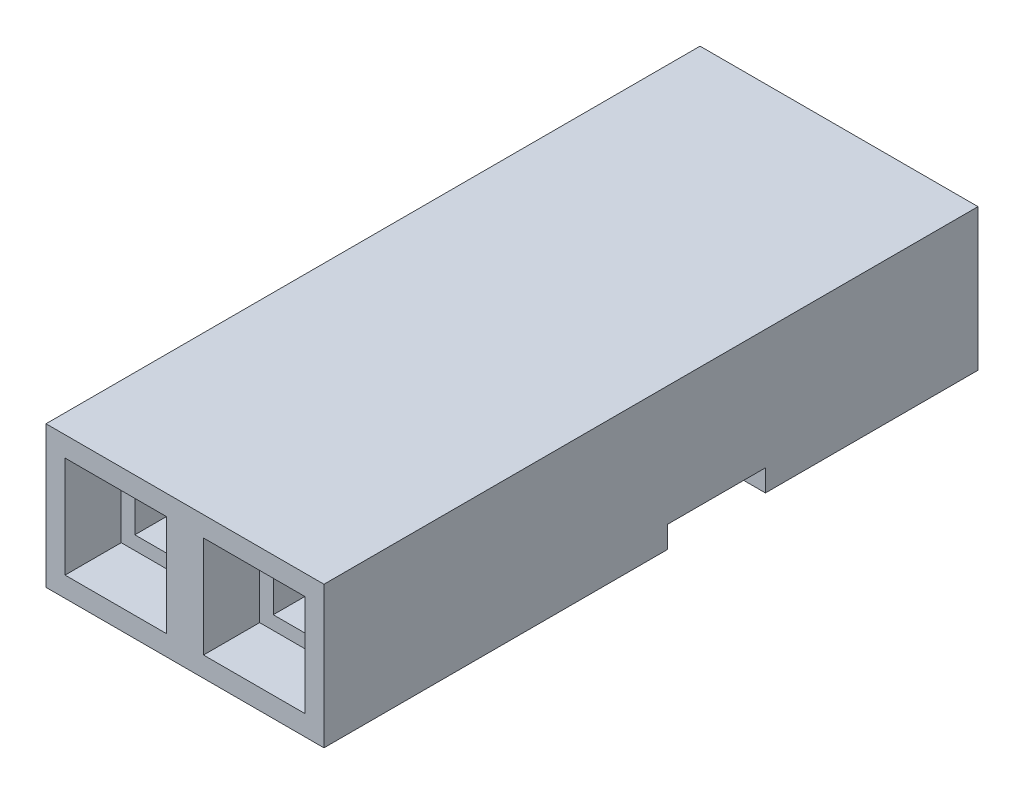
from build123d import *

# Parameters (mm, degrees)
SKETCH1_W               = 5.1
SKETCH1_H               = 14
BOSS_EXTRUDE1_DEPTH     = 1.3
SKETCH2_W               = 1.86
SKETCH2_H               = 1.86
CUT_EXTRUDE1_DEPTH      = 15.289594116
CUT_EXTRUDE2_DEPTH      = 8.562572314
CUT_EXTRUDE2_DEPTH_BACK = 8.562572314
SKETCH3_W               = 1.8
SKETCH3_H               = 0.4
CUT_EXTRUDE3_REACH      = 9.891
SKETCH8_W               = 0.1
SKETCH8_H               = 3.3
BOSS_EXTRUDE2_START     = -1
SKETCH5_W               = 1.86
SKETCH5_H               = 1.86
SKETCH5_W_2             = 0.9
SKETCH5_H_2             = 0.9
BOSS_EXTRUDE2_DEPTH     = 1
CHAMFER2_SIZE           = 0.5
SKETCH6_W               = 1.8
SKETCH6_H               = 1.8
SKETCH6_W_2             = 1.3
SKETCH6_H_2             = 1.3
BOSS_EXTRUDE3_DEPTH     = 10
BOSS_EXTRUDE3_2_DEPTH   = 10
SKETCH7_W               = 1.8
SKETCH7_H               = 1
BOSS_EXTRUDE4_DEPTH     = 0.1
SKETCH9_W               = 5.1
SKETCH9_H               = 2
CUT_EXTRUDE4_DEPTH      = 8.890659035
SKETCH10_W              = 0.9
SKETCH10_H              = 0.85
CUT_EXTRUDE5_DEPTH      = 1


with BuildPart() as part:
    # Sketch1 → Boss-Extrude1 (new, symmetric)
    with BuildSketch(Plane(origin=(0, 0, 0), x_dir=(1, 0, 0), z_dir=(0, 1, 0))):
        Rectangle(SKETCH1_W, SKETCH1_H)
    extrude(amount=BOSS_EXTRUDE1_DEPTH, both=True)

    # Sketch2 → Cut-Extrude1 (cut, through all)
    with BuildSketch(Plane(origin=(0, 0, -7), x_dir=(-1, 0, 0), z_dir=(0, 0, -1))):
        with Locations((-1.27, 0)):
            Rectangle(SKETCH2_W, SKETCH2_H)
        with Locations((1.27, 0)):
            Rectangle(SKETCH2_W, SKETCH2_H)
    extrude(amount=-CUT_EXTRUDE1_DEPTH, mode=Mode.SUBTRACT)

    # Sketch3 → Cut-Extrude2 (cut, two sides: drawn at the far end of the back side and taken through both)
    with BuildSketch(Plane(origin=(0, 0, 0), x_dir=(0, 0, -1), z_dir=(1, 0, 0)).offset(-CUT_EXTRUDE2_DEPTH_BACK)):
        with Locations((2.2, -1.1)):
            Rectangle(SKETCH3_W, SKETCH3_H)
    extrude(amount=CUT_EXTRUDE2_DEPTH + CUT_EXTRUDE2_DEPTH_BACK, mode=Mode.SUBTRACT)

    # Sketch8 → Cut-Extrude3 (cut, up to next)
    with BuildSketch(Plane.XZ.offset(1.3), mode=Mode.PRIVATE) as cut_extrude3_sk1:
        with Locations((-2.15, 0.35)):
            Rectangle(SKETCH8_W, SKETCH8_H)
    cut_extrude3_tool1 = extrude(cut_extrude3_sk1.sketch, amount=-CUT_EXTRUDE3_REACH, mode=Mode.PRIVATE) & part.part
    # Sketch8 → Cut-Extrude3 (cut, up to next)
    with BuildSketch(Plane.XZ.offset(1.3), mode=Mode.PRIVATE) as cut_extrude3_sk2:
        with Locations((-0.39, 0.35)):
            Rectangle(SKETCH8_W, SKETCH8_H)
    cut_extrude3_tool2 = extrude(cut_extrude3_sk2.sketch, amount=-CUT_EXTRUDE3_REACH, mode=Mode.PRIVATE) & part.part
    # Sketch8 → Cut-Extrude3 (cut, up to next)
    with BuildSketch(Plane.XZ.offset(1.3), mode=Mode.PRIVATE) as cut_extrude3_sk3:
        with Locations((0.39, 0.35)):
            Rectangle(SKETCH8_W, SKETCH8_H)
    cut_extrude3_tool3 = extrude(cut_extrude3_sk3.sketch, amount=-CUT_EXTRUDE3_REACH, mode=Mode.PRIVATE) & part.part
    # Sketch8 → Cut-Extrude3 (cut, up to next)
    with BuildSketch(Plane.XZ.offset(1.3), mode=Mode.PRIVATE) as cut_extrude3_sk4:
        with Locations((2.15, 0.35)):
            Rectangle(SKETCH8_W, SKETCH8_H)
    cut_extrude3_tool4 = extrude(cut_extrude3_sk4.sketch, amount=-CUT_EXTRUDE3_REACH, mode=Mode.PRIVATE) & part.part
    add(cut_extrude3_tool1.solids().sort_by_distance((-2.15, -1.3, 0.35))[0], mode=Mode.SUBTRACT)
    add(cut_extrude3_tool2.solids().sort_by_distance((-0.39, -1.3, 0.35))[0], mode=Mode.SUBTRACT)
    add(cut_extrude3_tool3.solids().sort_by_distance((0.39, -1.3, 0.35))[0], mode=Mode.SUBTRACT)
    add(cut_extrude3_tool4.solids().sort_by_distance((2.15, -1.3, 0.35))[0], mode=Mode.SUBTRACT)

    # Sketch5 → Boss-Extrude2 (add)
    # profile 1 of 2: a face of its own
    with BuildSketch(Plane(origin=(0, 0, -7), x_dir=(-1, 0, 0), z_dir=(0, 0, -1)).offset(BOSS_EXTRUDE2_START)):
        with Locations((1.27, 0)):
            Rectangle(SKETCH5_W, SKETCH5_H)
        with Locations((1.27, 0)):
            Rectangle(SKETCH5_W_2, SKETCH5_H_2, mode=Mode.SUBTRACT)
    # profile 2 of 2: a face of its own
    with BuildSketch(Plane(origin=(0, 0, -7), x_dir=(-1, 0, 0), z_dir=(0, 0, -1)).offset(BOSS_EXTRUDE2_START)):
        with Locations((-1.27, 0)):
            Rectangle(SKETCH5_W, SKETCH5_H)
        with Locations((-1.27, 0)):
            Rectangle(SKETCH5_W_2, SKETCH5_H_2, mode=Mode.SUBTRACT)
    extrude(amount=BOSS_EXTRUDE2_DEPTH)

    # Chamfer2
    chamfer2_edges = [part.edges().sort_by_distance(p)[0] for p in [
        (-0.82, 0, -7),
        (-1.27, 0.45, -7),
        (-1.72, 0, -7),
        (-1.27, -0.45, -7),
        (1.72, 0, -7),
        (1.27, 0.45, -7),
        (0.82, 0, -7),
        (1.27, -0.45, -7),
    ]]
    chamfer(chamfer2_edges, length=CHAMFER2_SIZE)

    # Sketch9 → Cut-Extrude4 (cut, through all)
    with BuildSketch(Plane(origin=(0, 1.3, 0), x_dir=(1, 0, 0), z_dir=(0, 1, 0))):
        with Locations((0, -6)):
            Rectangle(SKETCH9_W, SKETCH9_H)
    extrude(amount=-CUT_EXTRUDE4_DEPTH, mode=Mode.SUBTRACT)

    # Sketch10 → Cut-Extrude5 (cut)
    with BuildSketch(Plane(origin=(0, 0, -7), x_dir=(-1, 0, 0), z_dir=(0, 0, -1))):
        with Locations((-1.27, -0.875)):
            Rectangle(SKETCH10_W, SKETCH10_H)
        with Locations((1.27, -0.875)):
            Rectangle(SKETCH10_W, SKETCH10_H)
    extrude(amount=-CUT_EXTRUDE5_DEPTH, mode=Mode.SUBTRACT)


with BuildPart() as body_2:
    # Sketch6 → Boss-Extrude3 (new body)
    with BuildSketch(Plane.XY.offset(-6)):
        with Locations((-1.27, 0)):
            Rectangle(SKETCH6_W, SKETCH6_H)
        with Locations((-1.27, 0)):
            Rectangle(SKETCH6_W_2, SKETCH6_H_2, mode=Mode.SUBTRACT)
    extrude(amount=BOSS_EXTRUDE3_DEPTH)



with BuildPart() as body_3:
    # Sketch6 → Boss-Extrude3 2 (new body)
    with BuildSketch(Plane.XY.offset(-6)):
        with Locations((1.27, 0)):
            Rectangle(SKETCH6_W, SKETCH6_H)
        with Locations((1.27, 0)):
            Rectangle(SKETCH6_W_2, SKETCH6_H_2, mode=Mode.SUBTRACT)
    extrude(amount=BOSS_EXTRUDE3_2_DEPTH)


with BuildPart() as body_2_1:
    add(body_2.part)

    add(body_3.part)  # Boss-Extrude4 merges body 3
    # Sketch7 → Boss-Extrude4 (add)
    with BuildSketch(Plane.XZ.offset(0.9)):
        with Locations((-1.27, -1.9)):
            Rectangle(SKETCH7_W, SKETCH7_H)
        with Locations((1.27, -1.9)):
            Rectangle(SKETCH7_W, SKETCH7_H)
    extrude(amount=BOSS_EXTRUDE4_DEPTH)


solid = Compound([part.part, body_2_1.part])
